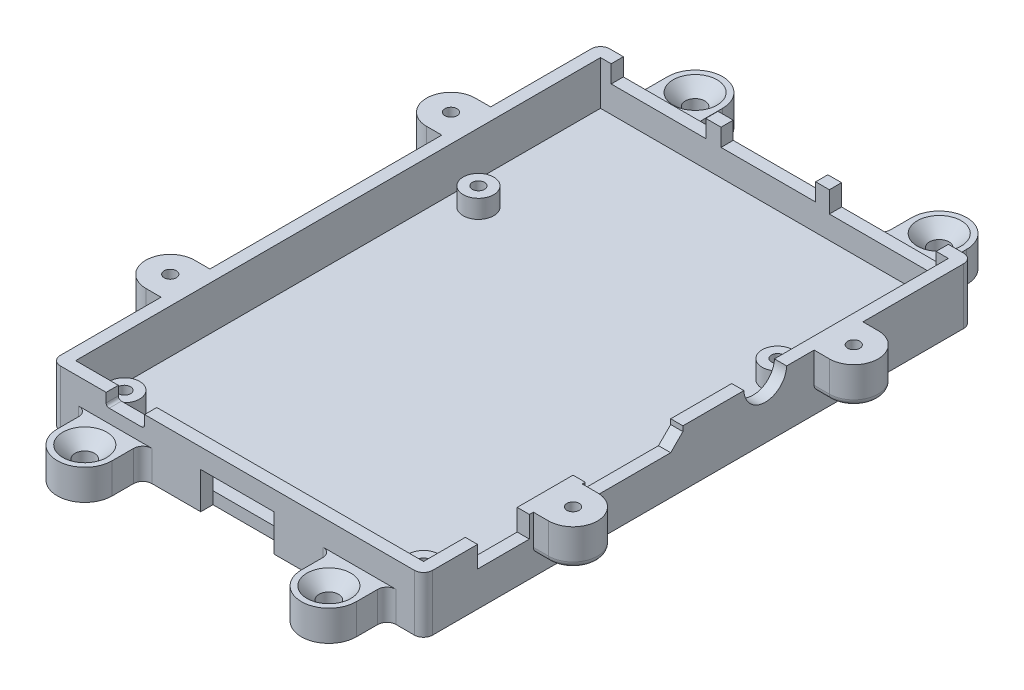
from build123d import *

# Parameters (mm, degrees)
SKETCH_1_W               = 61
SKETCH_1_H               = 90
EXTRUDE_461_DEPTH        = 9.2
SKETCH_2_W               = 57
SKETCH_2_H               = 86
CUT_EXTRUDE_685_DEPTH    = 7.2
SKETCH_3_R               = 2.5
SKETCH_3_R_2             = 1
EXTRUDE_939_DEPTH        = 3
SKETCH_4_W               = 8.5
SKETCH_4_H               = 4
MICROUSB_DEPTH           = 2
SKETCH_5_W               = 16
SKETCH_5_H               = 6.05
HDMI_DEPTH               = 2
SKETCH_6_R               = 3.5
CUT_EXTRUDE_1702_DEPTH   = 2
SKETCH_7_W               = 17.5
SKETCH_7_H               = 14
ETHERNET_DEPTH           = 2
SKETCH_8_W               = 15.5
SKETCH_8_H               = 16.12
USB_DEPTH                = 2
PATTERN_LINEAR_1_COUNT   = 2
PATTERN_LINEAR_1_PITCH   = 18
SKETCH_9_W               = 12
SKETCH_9_H               = 6
MICROSD_DEPTH            = 2
SKETCH_10_R              = 1.6
EXTRUDE_2923_DEPTH       = 5
MIRROR_2_COPY_1_SKETCH_R = 1.6
MIRROR_2_COPY_1_DEPTH    = 5
SKETCH_11_R              = 1
EXTRUDE_3371_DEPTH       = 6
MIRROR_4_COPY_1_SKETCH_R = 1
MIRROR_4_COPY_1_DEPTH    = 6
CHAMFER_1_SIZE           = 2
FILLET_1_R               = 1
FILLET_2_R               = 1.5
SKETCH_12_W              = 6.3
SKETCH_12_H              = 2
CUT_EXTRUDE_5754_DEPTH   = 2
FILLET_3_R               = 0.5
CHAMFER_2_SIZE           = 2


with BuildPart() as part:
    # Эскиз1 → Extrude 461 (new body)
    with BuildSketch(Plane(origin=(0, 0, 0), x_dir=(1, 0, 0), z_dir=(0, 1, 0))):
        Rectangle(SKETCH_1_W, SKETCH_1_H)
    extrude(amount=EXTRUDE_461_DEPTH)

    # Эскиз2 → Cut-Extrude 685 (cut)
    with BuildSketch(Plane(origin=(0, 9.2, 0), x_dir=(1, 0, 0), z_dir=(0, 1, 0))):
        Rectangle(SKETCH_2_W, SKETCH_2_H)
    extrude(amount=-CUT_EXTRUDE_685_DEPTH, mode=Mode.SUBTRACT)

    # Эскиз3 → Extrude 939 (add)
    # profile 1 of 4: a face of its own
    with BuildSketch(Plane(origin=(0, 2, 0), x_dir=(1, 0, 0), z_dir=(0, 1, 0))):
        with Locations(Location((-24.5, 19, 0), (0, 0, 270))):
            Circle(SKETCH_3_R)
        with Locations(Location((-24.5, 19, 0), (0, 0, 270))):
            Circle(SKETCH_3_R_2, mode=Mode.SUBTRACT)
    # profile 2 of 4: a face of its own
    with BuildSketch(Plane(origin=(0, 2, 0), x_dir=(1, 0, 0), z_dir=(0, 1, 0))):
        with Locations(Location((24.5, 19, 0), (0, 0, 270))):
            Circle(SKETCH_3_R)
        with Locations(Location((24.5, 19, 0), (0, 0, 270))):
            Circle(SKETCH_3_R_2, mode=Mode.SUBTRACT)
    # profile 3 of 4: a face of its own
    with BuildSketch(Plane(origin=(0, 2, 0), x_dir=(1, 0, 0), z_dir=(0, 1, 0))):
        with Locations(Location((24.5, -39, 0), (0, 0, 270))):
            Circle(SKETCH_3_R)
        with Locations(Location((24.5, -39, 0), (0, 0, 270))):
            Circle(SKETCH_3_R_2, mode=Mode.SUBTRACT)
    # profile 4 of 4: a face of its own
    with BuildSketch(Plane(origin=(0, 2, 0), x_dir=(1, 0, 0), z_dir=(0, 1, 0))):
        with Locations(Location((-24.5, -39, 0), (0, 0, 270))):
            Circle(SKETCH_3_R)
        with Locations(Location((-24.5, -39, 0), (0, 0, 270))):
            Circle(SKETCH_3_R_2, mode=Mode.SUBTRACT)
    extrude(amount=EXTRUDE_939_DEPTH)

    # Эскиз4 → microusb (cut)
    with BuildSketch(Plane(origin=(30.5, 0, 0), x_dir=(0, 0, -1), z_dir=(1, 0, 0))):
        with Locations((-31.9, 7.7)):
            Rectangle(SKETCH_4_W, SKETCH_4_H)
    extrude(amount=-MICROUSB_DEPTH, mode=Mode.SUBTRACT)

    # Эскиз5 → hdmi (cut)
    with BuildSketch(Plane(origin=(30.5, 0, 0), x_dir=(0, 0, -1), z_dir=(1, 0, 0))):
        with Locations((-10.5, 9.405)):
            Rectangle(SKETCH_5_W, SKETCH_5_H)
    extrude(amount=-HDMI_DEPTH, mode=Mode.SUBTRACT)

    # Эскиз6 → Cut-Extrude 1702 (cut)
    with BuildSketch(Plane(origin=(30.5, 0, 0), x_dir=(0, 0, -1), z_dir=(1, 0, 0))):
        with Locations((11, 9.3)):
            Circle(SKETCH_6_R)
    extrude(amount=-CUT_EXTRUDE_1702_DEPTH, mode=Mode.SUBTRACT)

    # Эскиз7 → ethernet (cut)
    with BuildSketch(Plane(origin=(0, 0, -45), x_dir=(-1, 0, 0), z_dir=(0, 0, -1))):
        with Locations((-17.75, 12.75)):
            Rectangle(SKETCH_7_W, SKETCH_7_H)
    extrude(amount=-ETHERNET_DEPTH, mode=Mode.SUBTRACT)

    # Эскиз8 → usb (cut)
    with BuildSketch(Plane(origin=(0, 0, -45), x_dir=(-1, 0, 0), z_dir=(0, 0, -1))):
        with Locations((1, 14.39)):
            Rectangle(SKETCH_8_W, SKETCH_8_H)
    usb = extrude(amount=-USB_DEPTH, mode=Mode.SUBTRACT)

    # Линейный массив1: usb ×2
    with Locations(*[(-i * PATTERN_LINEAR_1_PITCH, 0, 0) for i in range(1, PATTERN_LINEAR_1_COUNT)]):
        add(usb, mode=Mode.SUBTRACT)

    # Эскиз9 → microsd (cut)
    with BuildSketch(Plane.XY.offset(45)):
        with Locations((0, 3)):
            Rectangle(SKETCH_9_W, SKETCH_9_H)
    extrude(amount=-MICROSD_DEPTH, mode=Mode.SUBTRACT)

    # Эскиз10 → Extrude 2923 (add)
    with BuildSketch(Plane.XZ):
        with BuildLine():
            Line((-24.5, 50), (-24.5, 45))
            Line((-24.5, 45), (-15.5, 45))
            Line((-15.5, 45), (-15.5, 50))
            ThreePointArc((-15.5, 50), (-20, 54.5), (-24.5, 50))
        make_face()
        with Locations(Location((-20, 50, 0), (0, 0, 270))):
            Circle(SKETCH_10_R, mode=Mode.SUBTRACT)
    extrude_2923 = extrude(amount=-EXTRUDE_2923_DEPTH)

    # Зеркальное отражение1: Extrude 2923 across plane
    add(extrude_2923.mirror(Plane(origin=(0, 0, 0), x_dir=(0, 0, 1), z_dir=(1, 0, 0))))

    # Зеркальное отражение2: Extrude 2923 across plane
    add(extrude_2923.mirror(Plane.XY))

    # Зеркальное отражение2 copy 1 sketch → Зеркальное отражение2 copy 1 (add)
    with BuildSketch(Plane(origin=(0, 0, 0), x_dir=(-1, 0, 0), z_dir=(0, -1, 0))):
        with BuildLine():
            Line((-24.5, 50), (-24.5, 45))
            Line((-24.5, 45), (-15.5, 45))
            Line((-15.5, 45), (-15.5, 50))
            ThreePointArc((-15.5, 50), (-20, 54.5), (-24.5, 50))
        make_face()
        with Locations(Location((-20, 50, 0), (0, 0, 270))):
            Circle(MIRROR_2_COPY_1_SKETCH_R, mode=Mode.SUBTRACT)
    extrude(amount=-MIRROR_2_COPY_1_DEPTH)

    # Эскиз11 → Extrude 3371 (add)
    with BuildSketch(Plane(origin=(0, 9.2, 0), x_dir=(1, 0, 0), z_dir=(0, 1, 0))):
        with BuildLine():
            Line((-33, 27), (-30.5, 27))
            Line((-30.5, 27), (-30.5, 19))
            Line((-30.5, 19), (-33, 19))
            ThreePointArc((-33, 19), (-37, 23), (-33, 27))
        make_face()
        with Locations(Location((-33, 23, 0), (0, 0, 270))):
            Circle(SKETCH_11_R, mode=Mode.SUBTRACT)
    extrude_3371 = extrude(amount=-EXTRUDE_3371_DEPTH)

    # Зеркальное отражение3: Extrude 3371 across plane
    add(extrude_3371.mirror(Plane(origin=(0, 0, 0), x_dir=(0, 0, 1), z_dir=(1, 0, 0))))

    # Зеркальное отражение4: Extrude 3371 across plane
    add(extrude_3371.mirror(Plane.XY))

    # Зеркальное отражение4 copy 1 sketch → Зеркальное отражение4 copy 1 (add)
    with BuildSketch(Plane(origin=(0, 9.2, 0), x_dir=(-1, 0, 0), z_dir=(0, 1, 0))):
        with BuildLine():
            Line((-33, 27), (-30.5, 27))
            Line((-30.5, 27), (-30.5, 19))
            Line((-30.5, 19), (-33, 19))
            ThreePointArc((-33, 19), (-37, 23), (-33, 27))
        make_face()
        with Locations(Location((-33, 23, 0), (0, 0, 270))):
            Circle(MIRROR_4_COPY_1_SKETCH_R, mode=Mode.SUBTRACT)
    extrude(amount=-MIRROR_4_COPY_1_DEPTH)

    # Фаска1
    chamfer_1_edges = [part.edges().sort_by_distance(p)[0] for p in [
        (29.5, 6.38, 18.5),
        (29.5, 6.38, 2.5),
    ]]
    chamfer(chamfer_1_edges, length=CHAMFER_1_SIZE)

    # Скругление1
    fillet_1_edges = [part.edges().sort_by_distance(p)[0] for p in [
        (-37, 3.2, -23),
        (-31.75, 3.2, -27),
        (-31.75, 3.2, -19),
        (37, 3.2, -23),
        (31.75, 3.2, -19),
        (31.75, 3.2, -27),
        (37, 3.2, 23),
        (31.75, 3.2, 27),
        (31.75, 3.2, 19),
        (-37, 3.2, 23),
        (-31.75, 3.2, 19),
        (-31.75, 3.2, 27),
    ]]
    fillet(fillet_1_edges, radius=FILLET_1_R)

    # Скругление2
    fillet_2_edges = [part.edges().sort_by_distance(p)[0] for p in [
        (-15.5, 2.5, 45),
        (-24.5, 2.5, 45),
        (24.5, 2.5, 45),
        (15.5, 2.5, 45),
        (15.5, 2.5, -45),
        (24.5, 2.5, -45),
        (-24.5, 2.5, -45),
        (-15.5, 2.5, -45),
        (-30.5, 4.6, -45),
        (30.5, 4.6, -45),
        (30.5, 4.6, 45),
        (-30.5, 4.6, 45),
    ]]
    fillet(fillet_2_edges, radius=FILLET_2_R)

    # Эскиз12 → Cut-Extrude 5754 (cut)
    with BuildSketch(Plane.XY.offset(45)):
        with Locations((-18.35, 8.2)):
            Rectangle(SKETCH_12_W, SKETCH_12_H)
    extrude(amount=-CUT_EXTRUDE_5754_DEPTH, mode=Mode.SUBTRACT)

    # Скругление3
    fillet_3_edges = [part.edges().sort_by_distance(p)[0] for p in [
        (-21.5, 7.2, 44),
        (-15.2, 7.2, 44),
    ]]
    fillet(fillet_3_edges, radius=FILLET_3_R)

    # Фаска2
    chamfer_2_edges = [part.edges().sort_by_distance(p)[0] for p in [
        (-20, 5, 51.6),
        (20, 5, 51.6),
        (20, 5, -51.6),
        (-20, 5, -51.6),
    ]]
    chamfer(chamfer_2_edges, length=CHAMFER_2_SIZE)


solid = part.part
